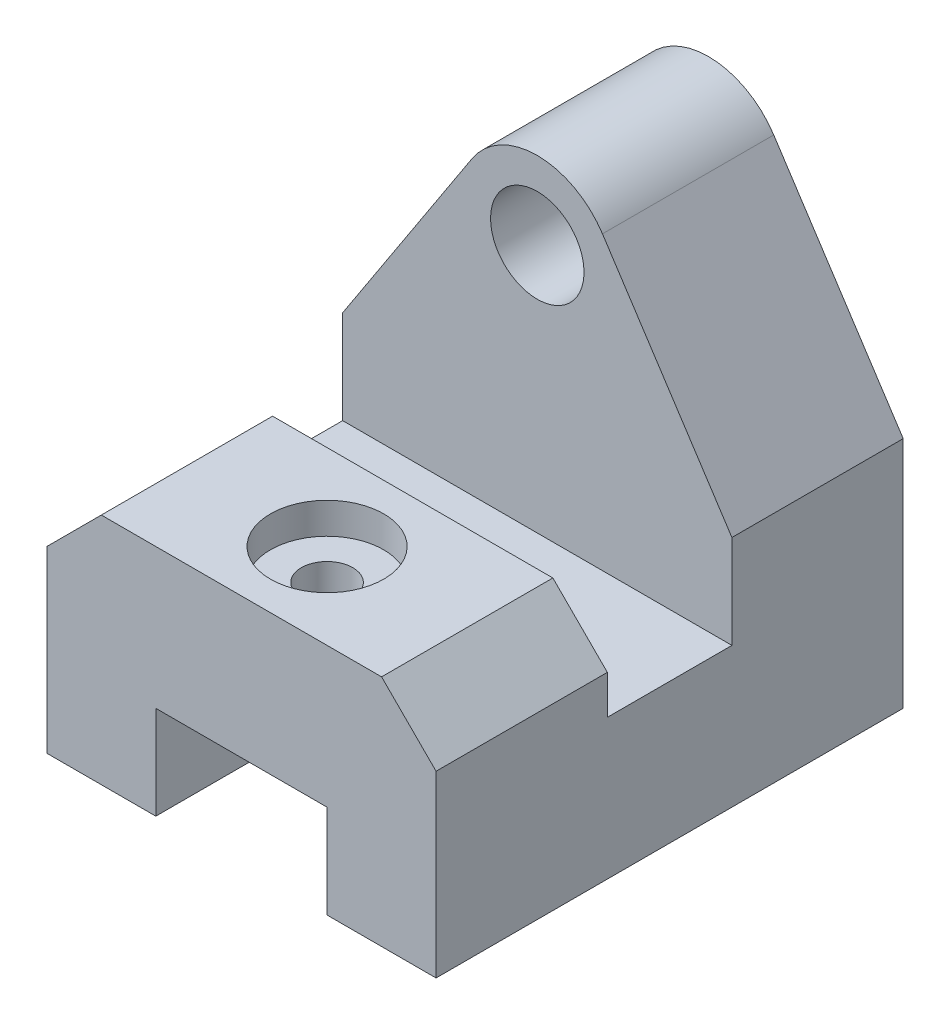
from build123d import *

# Parameters (mm, degrees)
SKETCH1_W                               = 50
SKETCH1_H                               = 30
BOSS_EXTRUDE1_DEPTH                     = 60
SKETCH2_R                               = 6
BOSS_EXTRUDE2_DEPTH                     = 22
SKETCH3_W                               = 16
SKETCH3_H                               = 12
CUT_EXTRUDE1_DEPTH                      = 99.488578018
SKETCH4_W                               = 22
SKETCH4_H                               = 12
CUT_EXTRUDE2_DEPTH                      = 99.488578018
CUT_EXTRUDE3_REACH                      = 100.489
CBORE_FOR_M6_HEX_HEAD_BOLT2_D           = 6.6
CBORE_FOR_M6_HEX_HEAD_BOLT2_CBORE_D     = 14.547
CBORE_FOR_M6_HEX_HEAD_BOLT2_CBORE_DEPTH = 4


with BuildPart() as part:
    # Sketch1 → Boss-Extrude1 (new body)
    with BuildSketch(Plane.XY):
        with Locations((25, 15)):
            Rectangle(SKETCH1_W, SKETCH1_H)
    extrude(amount=-BOSS_EXTRUDE1_DEPTH)

    # Sketch2 → Boss-Extrude2 (add)
    with BuildSketch(Plane(origin=(0, 0, -60), x_dir=(-1, 0, 0), z_dir=(0, 0, -1))):
        with BuildLine():
            Line((-50, 30), (-33.373426859, 55.466783574))
            ThreePointArc((-33.373426859, 55.466783574), (-25, 60), (-16.626573141, 55.466783574))
            Line((-16.626573141, 55.466783574), (0, 30))
            Line((0, 30), (-50, 30))
        make_face()
        with Locations((-25, 50)):
            Circle(SKETCH2_R, mode=Mode.SUBTRACT)
    extrude(amount=-BOSS_EXTRUDE2_DEPTH)

    # Sketch3 → Cut-Extrude1 (cut, through all)
    with BuildSketch(Plane(origin=(50, 0, 0), x_dir=(0, 0, -1), z_dir=(1, 0, 0))):
        with Locations((30, 24)):
            Rectangle(SKETCH3_W, SKETCH3_H)
    extrude(amount=-CUT_EXTRUDE1_DEPTH, mode=Mode.SUBTRACT)

    # Sketch4 → Cut-Extrude2 (cut, through all)
    with BuildSketch(Plane.XY):
        with Locations((25, 6)):
            Rectangle(SKETCH4_W, SKETCH4_H)
    extrude(amount=-CUT_EXTRUDE2_DEPTH, mode=Mode.SUBTRACT)

    # Sketch5 → Cut-Extrude3 (cut, up to next)
    with BuildSketch(Plane.XY, mode=Mode.PRIVATE) as cut_extrude3_sk1:
        Polygon((50, 30), (50, 23), (43, 30), align=None)
    cut_extrude3_tool1 = extrude(cut_extrude3_sk1.sketch, amount=-CUT_EXTRUDE3_REACH, mode=Mode.PRIVATE) & part.part
    # Sketch5 → Cut-Extrude3 (cut, up to next)
    with BuildSketch(Plane.XY, mode=Mode.PRIVATE) as cut_extrude3_sk2:
        Polygon((0, 23), (0, 30), (7, 30), align=None)
    cut_extrude3_tool2 = extrude(cut_extrude3_sk2.sketch, amount=-CUT_EXTRUDE3_REACH, mode=Mode.PRIVATE) & part.part
    add(cut_extrude3_tool1.solids().sort_by_distance((47.666667, 27.666667, 0))[0], mode=Mode.SUBTRACT)
    add(cut_extrude3_tool2.solids().sort_by_distance((2.333333, 27.666667, 0))[0], mode=Mode.SUBTRACT)

    # CBORE for M6 Hex Head Bolt2 (through all)
    with Locations(Plane(origin=(0, 30, 0), x_dir=(1, 0, 0), z_dir=(0, 1, 0))):
        with Locations((25, 11)):
            CounterBoreHole(CBORE_FOR_M6_HEX_HEAD_BOLT2_D / 2, CBORE_FOR_M6_HEX_HEAD_BOLT2_CBORE_D / 2, CBORE_FOR_M6_HEX_HEAD_BOLT2_CBORE_DEPTH)


solid = part.part
